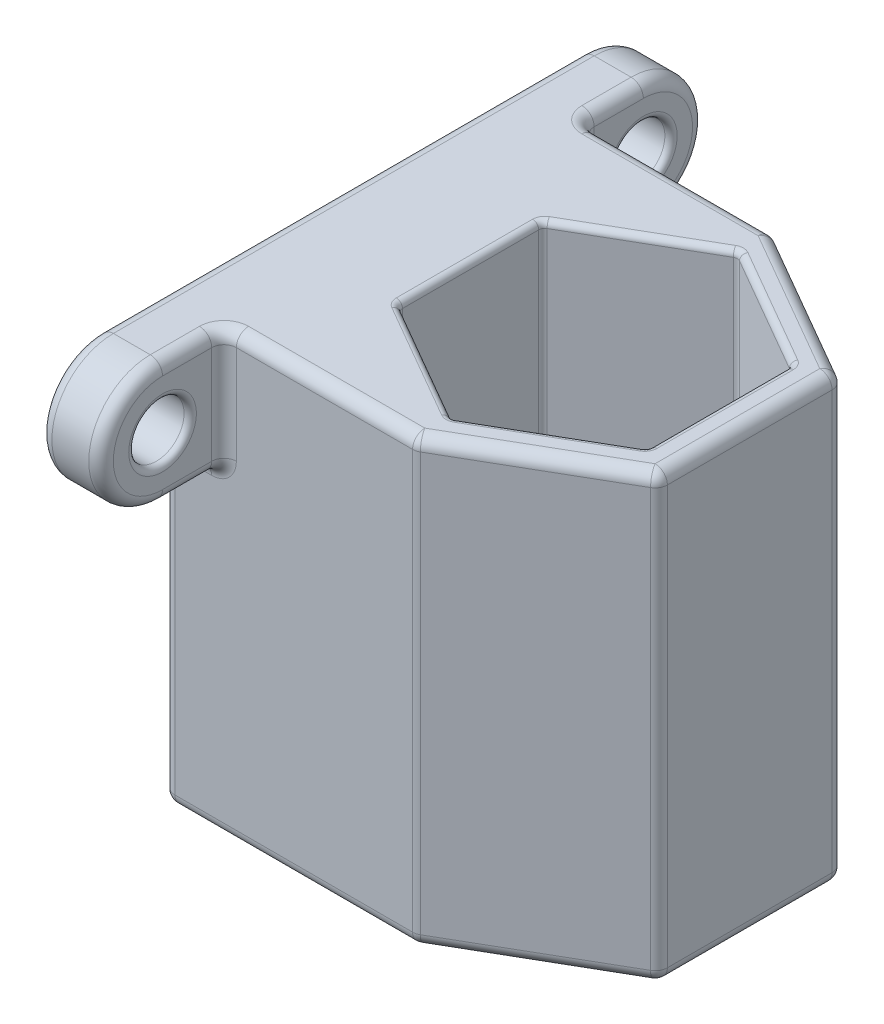
from build123d import *

# Parameters (mm, degrees)
BOSS_EXTRUDE1_DEPTH = 25
BOSS_EXTRUDE2_DEPTH = 2.5
BOSS_EXTRUDE3_DEPTH = 6
BOSS_EXTRUDE4_DEPTH = 2.5
SKETCH5_R           = 2.625
CUT_EXTRUDE1_DEPTH  = 41.822052864
BOSS_EXTRUDE5_DEPTH = 36
SKETCH7_R           = 5
SKETCH7_R_2         = 2.25
BOSS_EXTRUDE6_DEPTH = 5
SKETCH8_R           = 2.625
BOSS_EXTRUDE7_DEPTH = 0.2
FILLET1_R           = 0.5
FILLET2_R           = 1
FILLET3_R           = 0.5


with BuildPart() as part:
    # Sketch1 → Boss-Extrude1 (new body)
    with BuildSketch(Plane(origin=(0, 0, 0), x_dir=(1, 0, 0), z_dir=(0, 1, 0))):
        Polygon((12.6, -7.274613392), (12.6, 7.274613392), (0, 14.549226784), (-12.6, 7.274613392), (-12.6, -7.274613392), (0, -14.549226784), align=None)
        Polygon((0, -11.662475438), (10.1, -5.831237719), (10.1, 5.831237719), (0, 11.662475438), (-10.1, 5.831237719), (-10.1, -5.831237719), align=None, mode=Mode.SUBTRACT)
    extrude(amount=BOSS_EXTRUDE1_DEPTH)

    # Sketch2 → Boss-Extrude2 (add)
    with BuildSketch(Plane.XZ):
        Polygon((0, -14.549226784), (12.6, -7.274613392), (12.6, 7.274613392), (0, 14.549226784), (-12.6, 7.274613392), (-12.6, -7.274613392), align=None)
    extrude(amount=BOSS_EXTRUDE2_DEPTH)

    # Sketch3 → Boss-Extrude3 (add)
    with BuildSketch(Plane.XZ.offset(2.5)):
        Polygon((0, -14.549226784), (12.6, -7.274613392), (12.6, 7.274613392), (0, 14.549226784), (-12.6, 7.274613392), (-12.6, -7.274613392), align=None)
        Polygon((0, -4.618802154), (4, -2.309401077), (4, 2.309401077), (0, 4.618802154), (-4, 2.309401077), (-4, -2.309401077), align=None, mode=Mode.SUBTRACT)
    extrude(amount=BOSS_EXTRUDE3_DEPTH)

    # Sketch4 → Boss-Extrude4 (add)
    with BuildSketch(Plane.XZ.offset(8.5)):
        Polygon((0, -14.549226784), (12.6, -7.274613392), (12.6, 7.274613392), (0, 14.549226784), (-12.6, 7.274613392), (-12.6, -7.274613392), align=None)
    extrude(amount=BOSS_EXTRUDE4_DEPTH)

    # Sketch5 → Cut-Extrude1 (cut, through all)
    with BuildSketch(Plane.XZ.offset(11)):
        with Locations(Location((0, 0, 0), (0, 0, 270))):
            Circle(SKETCH5_R)
    extrude(amount=-CUT_EXTRUDE1_DEPTH, mode=Mode.SUBTRACT)

    # Sketch6 → Boss-Extrude5 (add)
    with BuildSketch(Plane.XZ.offset(11)):
        Polygon((0, 14.549226784), (-20.6, 14.549226784), (-20.6, -14.549226784), (0, -14.549226784), (-12.6, -7.274613392), (-12.6, 7.274613392), align=None)
    extrude(amount=-BOSS_EXTRUDE5_DEPTH)

    # Sketch7 → Boss-Extrude6 (add)
    # profile 1 of 6: a face of its own
    with BuildSketch(Plane.ZY.offset(20.6)):
        with BuildLine():
            Line((-14.549226784, 25), (-19.549226784, 25))
            ThreePointArc((-19.549226784, 25), (-16.013692878, 23.535533906), (-14.549226784, 20))
            Line((-14.549226784, 20), (-14.549226784, 25))
        make_face()
    # profile 2 of 6: a face of its own
    with BuildSketch(Plane.ZY.offset(20.6)):
        with BuildLine():
            Line((-14.549226784, 15), (-14.549226784, 20))
            ThreePointArc((-14.549226784, 20), (-16.013692878, 16.464466094), (-19.549226784, 15))
            Line((-19.549226784, 15), (-14.549226784, 15))
        make_face()
    # profile 3 of 6: a face of its own
    with BuildSketch(Plane.ZY.offset(20.6)):
        with Locations((-19.549226784, 20)):
            Circle(SKETCH7_R)
        with Locations((-19.549226784, 20)):
            Circle(SKETCH7_R_2, mode=Mode.SUBTRACT)
    # profile 4 of 6: a face of its own
    with BuildSketch(Plane.ZY.offset(20.6)):
        with Locations((19.549226784, 20)):
            Circle(SKETCH7_R)
        with Locations((19.549226784, 20)):
            Circle(SKETCH7_R_2, mode=Mode.SUBTRACT)
    # profile 5 of 6: a face of its own
    with BuildSketch(Plane.ZY.offset(20.6)):
        with BuildLine():
            ThreePointArc((19.549226784, 15), (16.013692871, 16.464466101), (14.549226784, 20.000000019))
            Line((14.549226784, 20.000000019), (14.549226784, 15))
            Line((14.549226784, 15), (19.549226784, 15))
        make_face()
    # profile 6 of 6: a face of its own
    with BuildSketch(Plane.ZY.offset(20.6)):
        with BuildLine():
            Line((19.549226784, 25), (14.549226784, 25))
            Line((14.549226784, 25), (14.549226784, 20.000000019))
            ThreePointArc((14.549226784, 20.000000019), (16.013692884, 23.535533913), (19.549226784, 25))
        make_face()
    extrude(amount=-BOSS_EXTRUDE6_DEPTH)

    # Sketch8 → Boss-Extrude7 (add)
    with BuildSketch(Plane.XZ.offset(2.5)):
        with Locations(Location((0, 0, 0), (0, 0, 270))):
            Circle(SKETCH8_R)
    extrude(amount=-BOSS_EXTRUDE7_DEPTH)

    # Fillet1
    fillet1_edges = [part.edges().sort_by_distance(p)[0] for p in [
        (0, 0, 2.625),
        (-5.05, 0, 8.746856578),
        (-10.1, 12.5, 5.831237719),
        (5.05, 0, 8.746856578),
        (0, 12.5, 11.662475438),
        (10.1, 0, 0),
        (10.1, 12.5, 5.831237719),
        (5.05, 0, -8.746856578),
        (10.1, 12.5, -5.831237719),
        (-5.05, 0, -8.746856578),
        (0, 12.5, -11.662475438),
        (-10.1, 0, 0),
        (-10.1, 12.5, -5.831237719),
        (-5.05, 25, 8.746856578),
        (5.05, 25, 8.746856578),
        (10.1, 25, 0),
        (5.05, 25, -8.746856578),
        (-5.05, 25, -8.746856578),
        (-10.1, 25, 0),
    ]]
    fillet(fillet1_edges, radius=FILLET1_R)

    # Fillet2
    fillet2_edges = [part.edges().sort_by_distance(p)[0] for p in [
        (0, 7, 14.549226784),
        (0, 7, -14.549226784),
        (12.6, 7, -7.274613392),
        (12.6, 7, 7.274613392),
        (-10.3, -11, 14.549226784),
        (-20.6, -11, 0),
        (-10.3, -11, -14.549226784),
        (-7.8, 25, 14.549226784),
        (-20.6, 25, 0),
        (6.3, 25, -10.911920088),
        (-20.6, 2, -14.549226784),
        (-7.8, 25, -14.549226784),
        (-15.6, 15, -17.049226784),
        (-18.1, 15, -14.549226784),
        (-15.6, 20, -24.549226784),
        (-15.6, 25, -17.049226784),
        (-15.6, 20, -14.549226784),
        (-20.6, 20, -24.549226784),
        (-20.6, 15, -17.049226784),
        (-20.6, 2, 14.549226784),
        (-15.6, 20, 24.549226784),
        (-15.6, 15, 17.049226784),
        (-18.1, 15, 14.549226784),
        (-15.6, 20, 14.549226784),
        (-15.6, 25, 17.049226784),
        (-20.6, 20, 24.549226784),
        (-20.6, 15, 17.049226784),
        (6.3, 25, 10.911920088),
        (12.6, 25, 0),
        (6.3, -11, -10.911920088),
        (12.6, -11, 0),
        (6.3, -11, 10.911920088),
    ]]
    fillet(fillet2_edges, radius=FILLET2_R)

    # Fillet3
    fillet3_edges = [part.edges().sort_by_distance(p)[0] for p in [
        (0, -8.5, 2.625),
        (0, -11, 2.625),
        (-20.6, 20, -21.799226784),
        (-15.6, 20, -21.799226784),
        (-20.6, 20, 17.299226784),
        (-15.6, 20, 17.299226784),
    ]]
    fillet(fillet3_edges, radius=FILLET3_R)


solid = part.part
